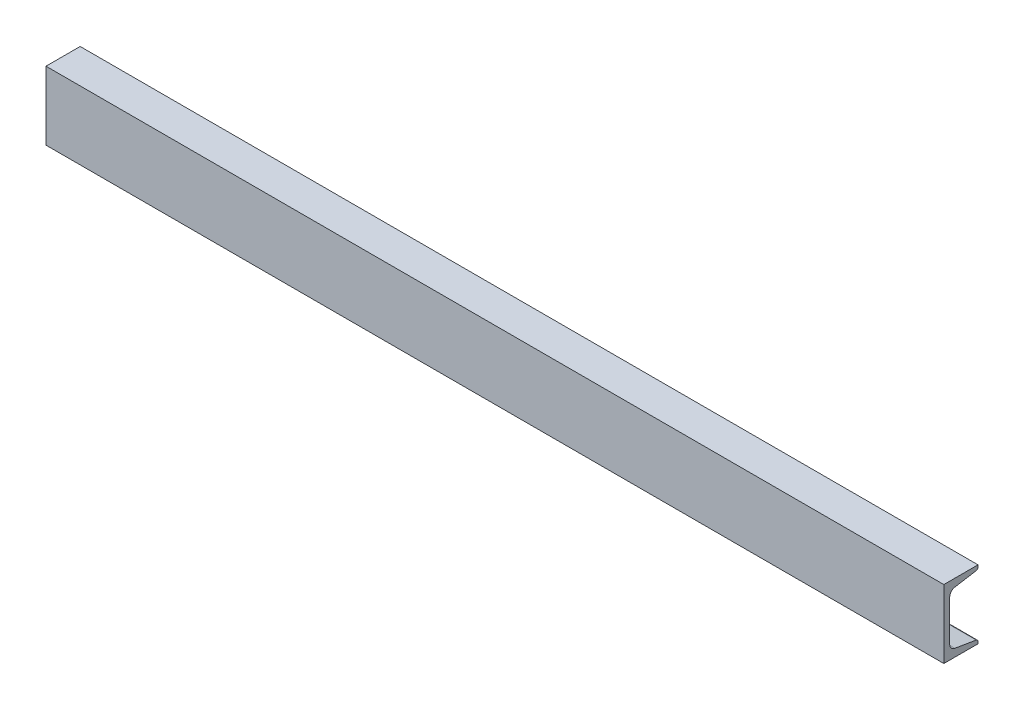
from build123d import *

# Parameters (mm, degrees)
CANAL_C_3_X_5_1_DEPTH = 1000


with BuildPart() as part:
    # Sketch12 → Canal c 3 X 5(1) (new body)
    with BuildSketch(Plane(origin=(0, 0, 0), x_dir=(0, 0, -1), z_dir=(1, 0, 0))):
        with BuildLine():
            Line((0, -38.1), (0, 38.1))
            Line((0, 38.1), (38.0492, 38.1))
            Line((38.0492, 38.1), (38.0492, 35.942335136))
            ThreePointArc((38.0492, 35.942335136), (37.447280466, 34.300554363), (35.926803066, 33.436899509))
            Line((35.926803066, 33.436899509), (12.283671721, 29.496090157))
            ThreePointArc((12.283671721, 29.496090157), (8.178382741, 27.164222052), (6.5532, 22.731413966))
            Line((6.5532, 22.731413966), (6.5532, -22.731413966))
            ThreePointArc((6.5532, -22.731413966), (8.178382741, -27.164222052), (12.283671721, -29.496090157))
            Line((12.283671721, -29.496090157), (35.926803066, -33.436899509))
            ThreePointArc((35.926803066, -33.436899509), (37.447280466, -34.300554363), (38.0492, -35.942335136))
            Line((38.0492, -35.942335136), (38.0492, -38.1))
            Line((38.0492, -38.1), (0, -38.1))
        make_face()
    extrude(amount=CANAL_C_3_X_5_1_DEPTH)


solid = part.part
